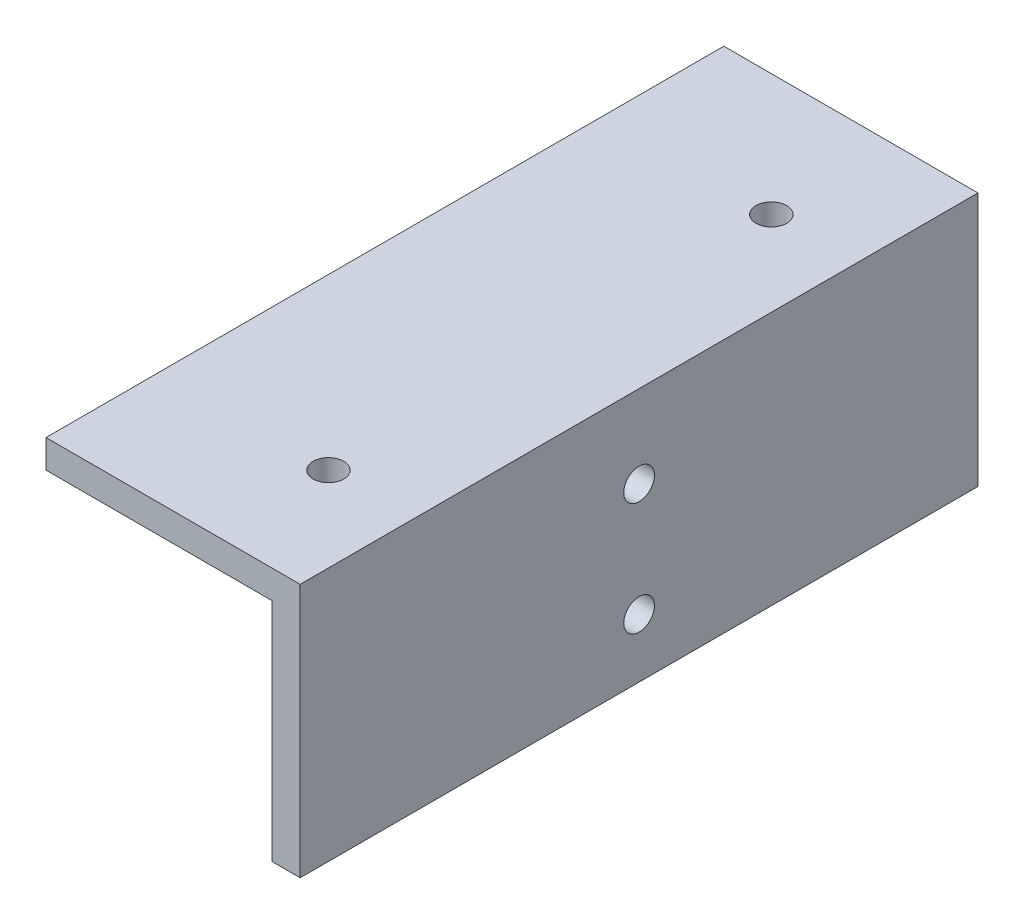
from build123d import *

# Parameters (mm, degrees)
BOSS_EXTRUDE1_DEPTH           = 76.2
TAP_DRILL_FOR_8_36_TAP1_D     = 3.4544
TAP_DRILL_FOR_8_36_TAP2_D     = 3.4544
TAP_DRILL_FOR_8_36_TAP2_DEPTH = 3.175


with BuildPart() as part:
    # Sketch1 → Boss-Extrude1 (new body)
    with BuildSketch(Plane.XY):
        Polygon((0, 0), (0, 28.575), (-28.575, 28.575), (-28.575, 25.4), (-3.175, 25.4), (-3.175, 0), align=None)
    extrude(amount=BOSS_EXTRUDE1_DEPTH)

    # Tap Drill for #8-36 Tap1 (through all)
    with Locations(Plane.ZY.offset(3.175)):
        with Locations((38.1, 6.6), (38.1, 19.3)):
            Hole(TAP_DRILL_FOR_8_36_TAP1_D / 2)

    # Tap Drill for #8-36 Tap2
    with Locations(Plane(origin=(0, 25.4, 0), x_dir=(-1, 0, 0), z_dir=(0, -1, 0))):
        with Locations((9.525, -63.5), (-28.575, -63.5), (9.525, -13.711593905), (-28.575, -13.711593905)):
            Hole(TAP_DRILL_FOR_8_36_TAP2_D / 2, depth=TAP_DRILL_FOR_8_36_TAP2_DEPTH)


solid = part.part
